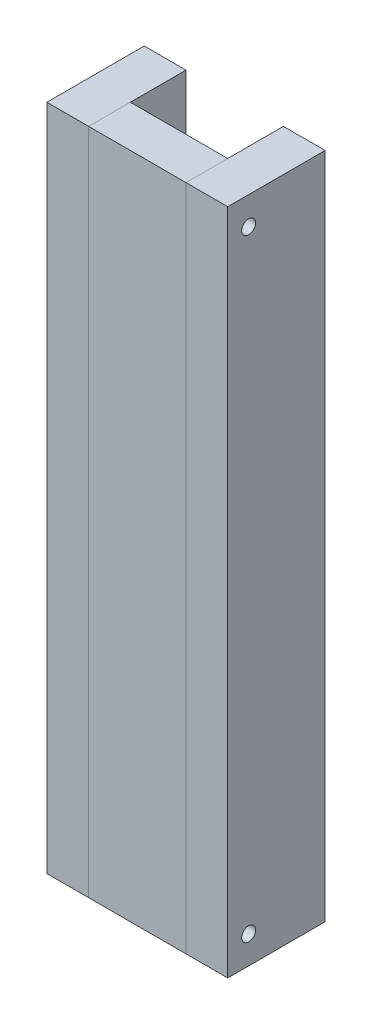
from build123d import *

# Parameters (mm, degrees)
SKETCH1_W             = 88.9
SKETCH1_H             = 609.6
BOSS_EXTRUDE1_DEPTH   = 38.1
SKETCH2_W             = 38.1
SKETCH2_H             = 88.9
BOSS_EXTRUDE2_DEPTH   = 609.6
BOSS_EXTRUDE2_2_DEPTH = 609.6
SKETCH3_R             = 6.35
CUT_EXTRUDE1_DEPTH    = 76.2


with BuildPart() as part:
    # Sketch1 → Boss-Extrude1 (new body)
    with BuildSketch(Plane.XY):
        Rectangle(SKETCH1_W, SKETCH1_H)
    extrude(amount=-BOSS_EXTRUDE1_DEPTH)


with BuildPart() as body_2:
    # Sketch2 → Boss-Extrude2 (new body)
    with BuildSketch(Plane(origin=(0, 304.8, 0), x_dir=(1, 0, 0), z_dir=(0, 1, 0))):
        with Locations((63.5, 44.45)):
            Rectangle(SKETCH2_W, SKETCH2_H)
    extrude(amount=-BOSS_EXTRUDE2_DEPTH)


with BuildPart() as body_3:
    # Sketch2 → Boss-Extrude2 2 (new body)
    with BuildSketch(Plane(origin=(0, 304.8, 0), x_dir=(1, 0, 0), z_dir=(0, 1, 0))):
        with Locations((-63.5, 44.45)):
            Rectangle(SKETCH2_W, SKETCH2_H)
    extrude(amount=-BOSS_EXTRUDE2_2_DEPTH)


with BuildPart() as cut_extrude1_tool:
    # Sketch3 → Cut-Extrude1 (new body)
    with BuildSketch(Plane.ZY.offset(82.55)):
        with Locations((-19.05, 279.4)):
            Circle(SKETCH3_R)
        with Locations((-19.05, -279.4)):
            Circle(SKETCH3_R)
    cut_extrude1 = extrude(amount=-CUT_EXTRUDE1_DEPTH)


with BuildPart() as part_1:
    add(part.part)

    # Cut-Extrude1: cut by cut_extrude1_tool
    add(cut_extrude1_tool.part, mode=Mode.SUBTRACT)


with BuildPart() as body_3_1:
    add(body_3.part)

    # Cut-Extrude1: cut by cut_extrude1_tool
    add(cut_extrude1_tool.part, mode=Mode.SUBTRACT)


with BuildPart() as mirror1_tool:
    # Mirror1: Cut-Extrude1 across plane
    add(cut_extrude1.mirror(Plane.ZY))


with BuildPart() as part_2:
    add(part_1.part)

    # Mirror1: cut by mirror1_tool
    add(mirror1_tool.part, mode=Mode.SUBTRACT)


with BuildPart() as body_2_1:
    add(body_2.part)

    # Mirror1: cut by mirror1_tool
    add(mirror1_tool.part, mode=Mode.SUBTRACT)


solid = Compound([body_3_1.part, part_2.part, body_2_1.part])
